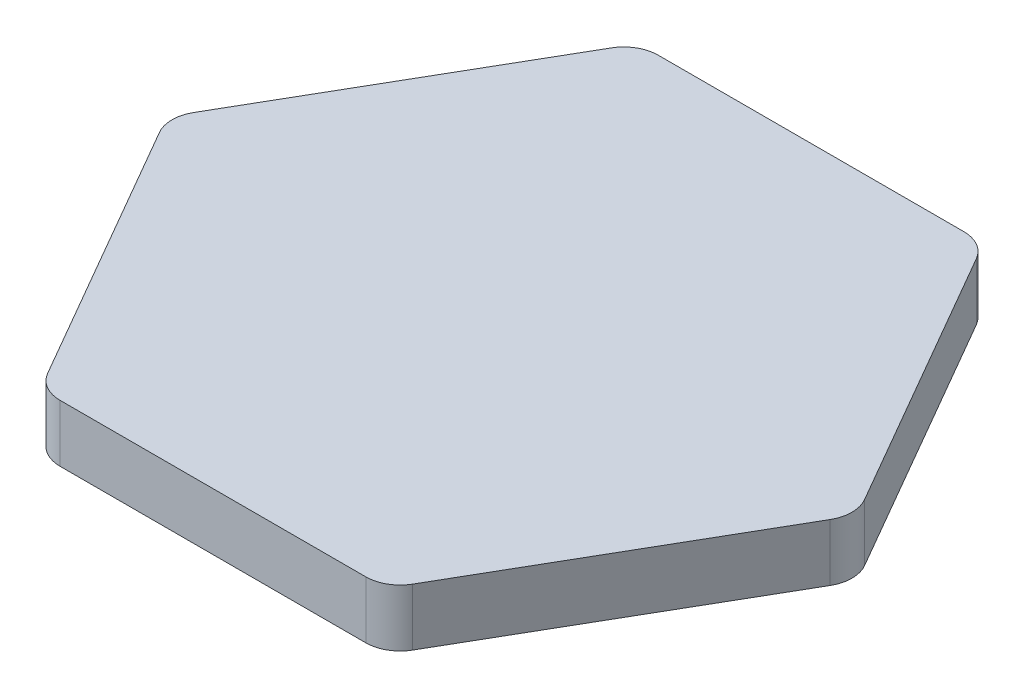
from build123d import *

# Parameters (mm, degrees)
BOSS_EXTRUDE1_DEPTH = 5
FILLET1_R           = 3


with BuildPart() as part:
    # Sketch1 → Boss-Extrude1 (new body)
    with BuildSketch(Plane(origin=(0, 0, 0), x_dir=(1, 0, 0), z_dir=(0, 1, 0))):
        Polygon((-30.200218536, 0), (-15.100109268, -26.154156452), (15.100109268, -26.154156452), (30.200218536, 0), (15.100109268, 26.154156452), (-15.100109268, 26.154156452), align=None)
    extrude(amount=BOSS_EXTRUDE1_DEPTH)

    # Fillet1
    fillet1_edges = [part.edges().sort_by_distance(p)[0] for p in [
        (-15.100109268, 2.5, -26.154156452),
        (15.100109268, 2.5, -26.154156452),
        (30.200218536, 2.5, 0),
        (15.100109268, 2.5, 26.154156452),
        (-15.100109268, 2.5, 26.154156452),
        (-30.200218536, 2.5, 0),
    ]]
    fillet(fillet1_edges, radius=FILLET1_R)


solid = part.part
